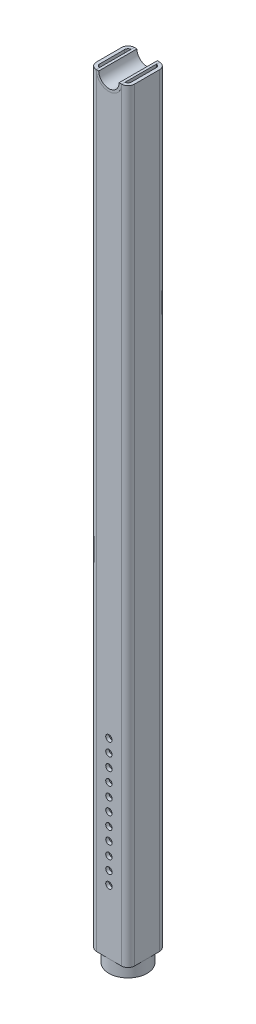
from build123d import *

# Parameters (mm, degrees)
SQUARE_TUBE_30_X_30_X_2_6_1_DEPTH = 600
SKETCH12_R                        = 15
SKETCH12_R_2                      = 12.4
BOSS_EXTRUDE1_DEPTH               = 10
SKETCH13_R                        = 2.5
CUT_EXTRUDE1_DEPTH                = 425.778068111
LPATTERN1_COUNT                   = 11
LPATTERN1_PITCH                   = 10
SKETCH14_R                        = 10
CUT_EXTRUDE3_DEPTH                = 43
BOSS_EXTRUDE2_DEPTH               = 30


with BuildPart() as part:
    # Sketch11 → Square tube 30 X 30 X 2.6(1) (new body)
    with BuildSketch(Plane.XZ.offset(-186.54822335)):
        with BuildLine():
            Line((-9.8, -15), (9.8, -15))
            ThreePointArc((9.8, -15), (13.476955262, -13.476955262), (15, -9.8))
            Line((15, -9.8), (15, 9.8))
            ThreePointArc((15, 9.8), (13.476955262, 13.476955262), (9.8, 15))
            Line((9.8, 15), (-9.8, 15))
            ThreePointArc((-9.8, 15), (-13.476955262, 13.476955262), (-15, 9.8))
            Line((-15, 9.8), (-15, -9.8))
            ThreePointArc((-15, -9.8), (-13.476955262, -13.476955262), (-9.8, -15))
        make_face()
        with BuildLine():
            Line((-9.8, -12.4), (9.8, -12.4))
            ThreePointArc((9.8, -12.4), (11.638477631, -11.638477631), (12.4, -9.8))
            Line((12.4, -9.8), (12.4, 9.8))
            ThreePointArc((12.4, 9.8), (11.638477631, 11.638477631), (9.8, 12.4))
            Line((9.8, 12.4), (-9.8, 12.4))
            ThreePointArc((-9.8, 12.4), (-11.638477631, 11.638477631), (-12.4, 9.8))
            Line((-12.4, 9.8), (-12.4, -9.8))
            ThreePointArc((-12.4, -9.8), (-11.638477631, -11.638477631), (-9.8, -12.4))
        make_face(mode=Mode.SUBTRACT)
    extrude(amount=SQUARE_TUBE_30_X_30_X_2_6_1_DEPTH)

    # Sketch13 → Cut-Extrude1 (cut, symmetric)
    with BuildSketch(Plane.XY.offset(15)):
        with Locations((0, -363.45177665)):
            Circle(SKETCH13_R)
    cut_extrude1 = extrude(amount=CUT_EXTRUDE1_DEPTH, both=True, mode=Mode.SUBTRACT)

    # LPattern1: Cut-Extrude1 ×11
    with Locations(*[(0, i * LPATTERN1_PITCH, 0) for i in range(1, LPATTERN1_COUNT)]):
        add(cut_extrude1, mode=Mode.SUBTRACT)

    # Sketch14 → Cut-Extrude3 (cut)
    with BuildSketch(Plane.XY.offset(15)):
        with Locations((0, 186.54822335)):
            Circle(SKETCH14_R)
    extrude(amount=-CUT_EXTRUDE3_DEPTH, mode=Mode.SUBTRACT)


with BuildPart() as body_2:
    # Sketch12 → Boss-Extrude1 (new body)
    with BuildSketch(Plane.XZ.offset(413.45177665)):
        with Locations(Location((0, 0, 0), (0, 0, 270))):
            Circle(SKETCH12_R)
        with Locations(Location((0, 0, 0), (0, 0, 270))):
            Circle(SKETCH12_R_2, mode=Mode.SUBTRACT)
    extrude(amount=BOSS_EXTRUDE1_DEPTH)


with BuildPart() as body_3:
    # Sketch15 → Boss-Extrude2 (new body)
    with BuildSketch(Plane.XY.offset(15)):
        with BuildLine():
            Line((-10.000947321, 186.54822335), (-8, 186.54822335))
            ThreePointArc((-8, 186.54822335), (0, 178.54822335), (8, 186.54822335))
            Line((8, 186.54822335), (10.000947321, 186.54822335))
            ThreePointArc((10.000947321, 186.54822335), (0, 176.547276029), (-10.000947321, 186.54822335))
        make_face()
    extrude(amount=-BOSS_EXTRUDE2_DEPTH)


solid = Compound([part.part, body_2.part, body_3.part])
